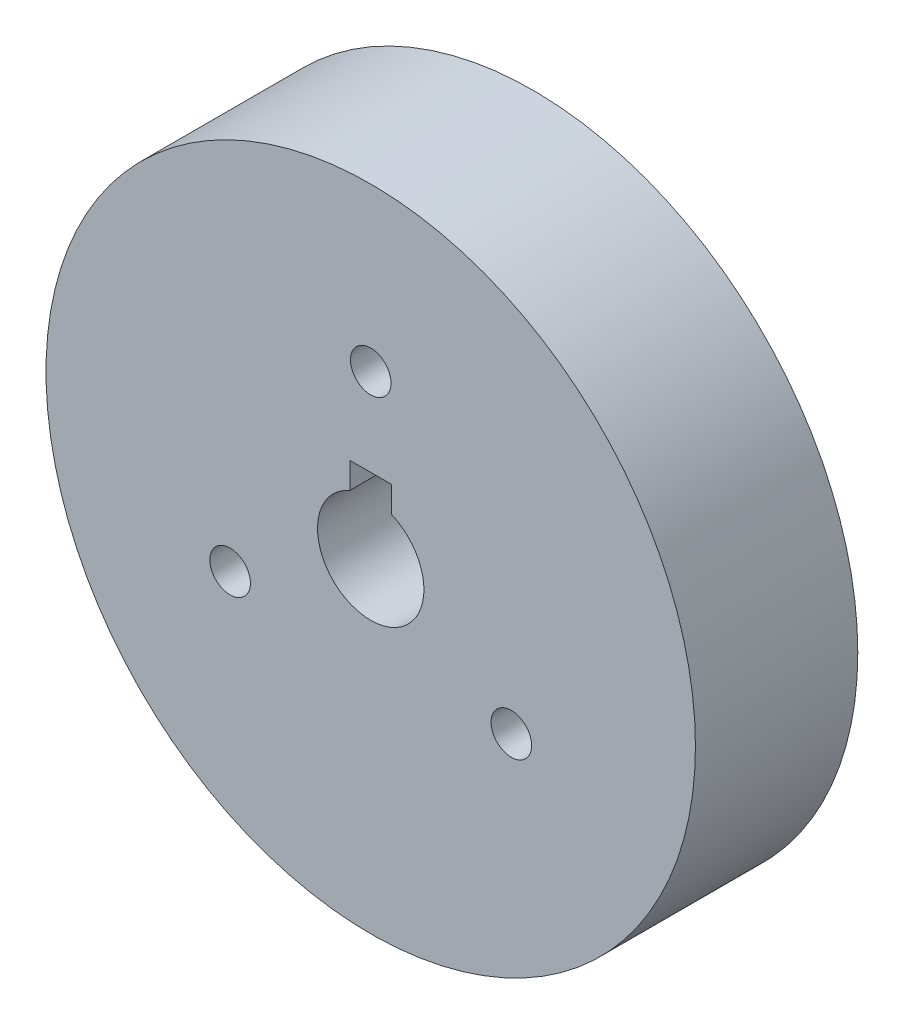
from build123d import *

# Parameters (mm, degrees)
SKETCH1_R               = 20
SKETCH1_R_2             = 1.250479472
SKETCH1_R_3             = 3.275
BOSS_EXTRUDE1_DEPTH     = 10
CUT_EXTRUDE1_DEPTH      = 31
CUT_EXTRUDE1_DEPTH_BACK = 31
SKETCH2_W               = 2.58125
SKETCH2_H               = 4.615625


with BuildPart() as part:
    # Sketch1 → Boss-Extrude1 (new body)
    with BuildSketch(Plane.XY):
        Circle(SKETCH1_R)
        with Locations((0, 10)):
            Circle(SKETCH1_R_2, mode=Mode.SUBTRACT)
        Circle(SKETCH1_R_3, mode=Mode.SUBTRACT)
        with Locations((8.660254038, -5)):
            Circle(SKETCH1_R_2, mode=Mode.SUBTRACT)
        with Locations((-8.660254038, -5)):
            Circle(SKETCH1_R_2, mode=Mode.SUBTRACT)
    extrude(amount=BOSS_EXTRUDE1_DEPTH)

    # Sketch2 → Cut-Extrude1 (cut, two sides: drawn at the far end of the back side and taken through both)
    with BuildSketch(Plane.XY.offset(10).offset(-CUT_EXTRUDE1_DEPTH_BACK)):
        with Locations((0, 2.3078125)):
            Rectangle(SKETCH2_W, SKETCH2_H)
    extrude(amount=CUT_EXTRUDE1_DEPTH + CUT_EXTRUDE1_DEPTH_BACK, mode=Mode.SUBTRACT)


solid = part.part
